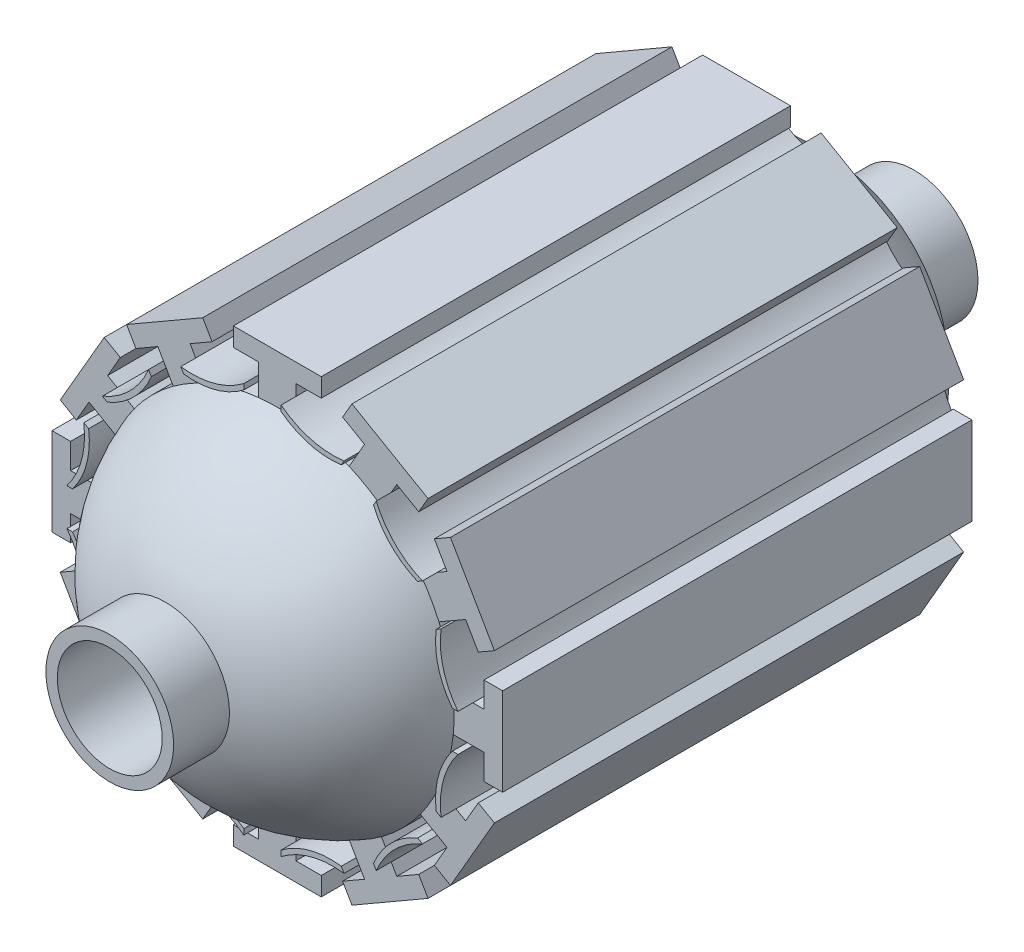
from build123d import *

# Parameters (mm, degrees)
SKETCH1_W                = 2.54
SKETCH1_H                = 1.27
BOSS_EXTRUDE1_DEPTH      = 32.004
BOSS_EXTRUDE2_DEPTH      = 43.434
BOSS_EXTRUDE2_DEPTH_BACK = 11.43
SKETCH2_R                = 4.3561
CIRPATTERN1_COUNT        = 12
BOSS_EXTRUDE3_START      = -1.016
BOSS_EXTRUDE3_DEPTH      = 34.036
CIRPATTERN2_COUNT        = 12
SKETCH6_R                = 12.065
BOSS_EXTRUDE4_DEPTH      = 32.004
CUT_EXTRUDE1_DEPTH       = 49.567496682
CUT_EXTRUDE1_DEPTH_BACK  = 49.567496682
SKETCH4_R                = 3.57505


with BuildPart() as part:
    # Sketch1 → Boss-Extrude1 (new body)
    with BuildSketch(Plane.XY):
        Polygon((1.27, 15.367), (1.27, 14.097), (1.524, 14.097), (2.9972, 14.097), (2.9972, 15.367), align=None)
        with Locations((0, 14.732)):
            Rectangle(SKETCH1_W, SKETCH1_H)
        Polygon((-2.9972, 15.367), (-2.9972, 14.097), (-1.524, 14.097), (-1.27, 14.097), (-1.27, 15.367), align=None)
        Polygon((1.27, 14.097), (-1.27, 14.097), (-1.27, 13.843), (-1.27, 0), (1.27, 0), (1.27, 13.843), align=None)
    boss_extrude1 = extrude(amount=BOSS_EXTRUDE1_DEPTH)

    # Sketch2 → Boss-Extrude2 (add, two sides: drawn at the far end of the back side and taken through both)
    with BuildSketch(Plane.XY.offset(-BOSS_EXTRUDE2_DEPTH_BACK)):
        Circle(SKETCH2_R)
    extrude(amount=BOSS_EXTRUDE2_DEPTH + BOSS_EXTRUDE2_DEPTH_BACK)

    # CirPattern1: Boss-Extrude1 ×12 about axis
    cirpattern1_axis = Axis((0, 0, 0), (0, 0, 1))
    for i in range(1, CIRPATTERN1_COUNT):
        add(boss_extrude1.rotate(cirpattern1_axis, i * 360 / CIRPATTERN1_COUNT))

    # Sketch3 → Boss-Extrude3 (add)
    with BuildSketch(Plane.XY.offset(BOSS_EXTRUDE3_START)):
        with BuildLine():
            ThreePointArc((-5.377147737, 11.853493081), (-3.21412165, 11.995265301), (-1.27, 12.954))
            Line((-1.27, 12.954), (-1.456826714, 13.197477313))
            ThreePointArc((-1.456826714, 13.197477313), (-3.304294977, 12.331796737), (-5.337089714, 12.157763976))
            Line((-5.337089714, 12.157763976), (-5.377147737, 11.853493081))
        make_face()
        with BuildLine():
            Line((-1.27, 12.954), (-1.27, 13.335))
            ThreePointArc((-1.27, 13.335), (-1.362727286, 13.265306619), (-1.456826714, 13.197477313))
            Line((-1.456826714, 13.197477313), (-1.27, 12.954))
        make_face()
        with BuildLine():
            Line((-5.567647737, 12.183448759), (-5.377147737, 11.853493081))
            Line((-5.377147737, 11.853493081), (-5.337089714, 12.157763976))
            ThreePointArc((-5.337089714, 12.157763976), (-5.452496861, 12.169456164), (-5.567647737, 12.183448759))
        make_face()
    boss_extrude3 = extrude(amount=BOSS_EXTRUDE3_DEPTH)

    # CirPattern2: Boss-Extrude3 ×12 about axis
    cirpattern2_axis = Axis((0, 0, 0), (0, 0, 1))
    for i in range(1, CIRPATTERN2_COUNT):
        add(boss_extrude3.rotate(cirpattern2_axis, i * 360 / CIRPATTERN2_COUNT))

    # Sketch5 → Revolve1 (revolve)
    with BuildSketch(Plane(origin=(0, 0, 0), x_dir=(0, 0, -1), z_dir=(1, 0, 0)), mode=Mode.PRIVATE) as revolve1_sk:
        with BuildLine():
            Line((7.62, 4.3561), (0, 4.3561))
            Line((0, 4.3561), (0, 12.065))
            ThreePointArc((0, 12.065), (4.712503935, 9.102646146), (7.62, 4.3561))
        make_face()
    revolve1 = revolve(revolve1_sk.sketch.rotate(Axis((0, 0, -11.43), (0, 0, 1)), 83.957671581), axis=Axis((0, 0, -11.43), (0, 0, 1)))

    # Sketch6 → Boss-Extrude4 (add)
    with BuildSketch(Plane.XY):
        Circle(SKETCH6_R)
    extrude(amount=BOSS_EXTRUDE4_DEPTH)

    # Mirror1: Revolve1 across plane
    add(revolve1.mirror(Plane(origin=(0, 0, 16.002), x_dir=(1, 0, 0), z_dir=(0, 0, -1))))

    # Sketch4 → Cut-Extrude1 (cut, two sides: drawn at the far end of the back side and taken through both)
    with BuildSketch(Plane.XY.offset(-CUT_EXTRUDE1_DEPTH_BACK)):
        Circle(SKETCH4_R)
    extrude(amount=CUT_EXTRUDE1_DEPTH + CUT_EXTRUDE1_DEPTH_BACK, mode=Mode.SUBTRACT)


solid = part.part
